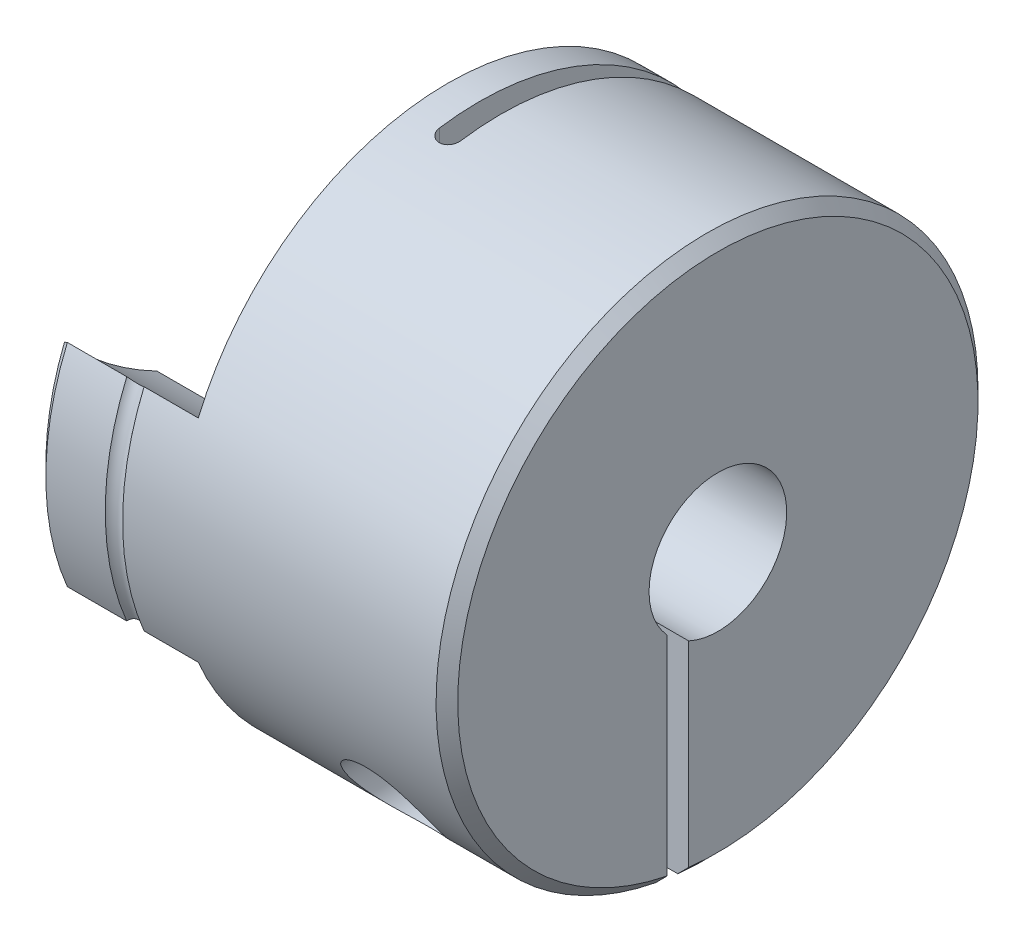
from build123d import *

# Parameters (mm, degrees)
SKETCH1_R                                            = 12.5
BOSS_EXTRUDE1_DEPTH                                  = 19
CUT_EXTRUDE1_REACH                                   = 27.952
SKETCH3_R                                            = 6.975
CUT_EXTRUDE2_DEPTH                                   = 6.54
SKETCH5_R                                            = 0.5
CUT_EXTRUDE4_DEPTH                                   = 17.5
CUT_EXTRUDE5_DEPTH                                   = 15
REFRENTADO_PARA_TORNILLO_TAP_N_CON_CABEZ_D           = 3.91
REFRENTADO_PARA_TORNILLO_TAP_N_CON_CABEZ_CBORE_D     = 6.5
REFRENTADO_PARA_TORNILLO_TAP_N_CON_CABEZ_CBORE_DEPTH = 8
CHAFL_N1_SIZE                                        = 0.5
DODANIE_WYCI_GNI_CIE1_START                          = -10
DODANIE_WYCI_GNI_CIE1_DEPTH                          = 10


with BuildPart() as part:
    # Sketch1 → Boss-Extrude1 (new body)
    with BuildSketch(Plane(origin=(0, 0, 0), x_dir=(0, 0, -1), z_dir=(1, 0, 0))):
        Circle(SKETCH1_R)
    extrude(amount=BOSS_EXTRUDE1_DEPTH)

    # Sketch3 → Cut-Extrude1 (cut, up to next)
    with BuildSketch(Plane.ZY, mode=Mode.PRIVATE) as cut_extrude1_sk1:
        Circle(SKETCH3_R)
    cut_extrude1_tool1 = extrude(cut_extrude1_sk1.sketch, amount=-CUT_EXTRUDE1_REACH, mode=Mode.PRIVATE) & part.part
    add(cut_extrude1_tool1.solids().sort_by_distance((0, 0, 0))[0], mode=Mode.SUBTRACT)

    # Sketch2 → Cut-Extrude2 (cut)
    with BuildSketch(Plane.ZY):
        with BuildLine():
            Line((6.876343086, 1.168987069), (6.876343086, -1.168987069))
            ThreePointArc((6.876343086, -1.168987069), (0, -29.5), (-6.876343086, -1.168987069))
            Line((-6.876343086, -1.168987069), (-6.876343086, 1.168987069))
            ThreePointArc((-6.876343086, 1.168987069), (0, 29.5), (6.876343086, 1.168987069))
        make_face()
    extrude(amount=-CUT_EXTRUDE2_DEPTH, mode=Mode.SUBTRACT)

    # Sketch5 → Cut-Revolve1 (revolve, cut)
    with BuildSketch(Plane(origin=(0, 0, 0), x_dir=(-1, 0, 0), z_dir=(0, -1, 0)), mode=Mode.PRIVATE) as cut_revolve1_sk:
        with Locations((-3.64, 12.8)):
            Circle(SKETCH5_R)
    revolve(cut_revolve1_sk.sketch.rotate(Axis((19, 0, 0), (-1, 0, 0)), 202.975957279), axis=Axis((19, 0, 0), (-1, 0, 0)), mode=Mode.SUBTRACT)

    # Sketch6 → Cut-Extrude4 (cut, symmetric)
    with BuildSketch(Plane(origin=(0, 0, 0), x_dir=(1, 0, 0), z_dir=(0, 1, 0))):
        with BuildLine():
            Line((9, 14.85), (9, -1.85))
            ThreePointArc((9, -1.85), (8.5, -2.35), (8, -1.85))
            Line((8, -1.85), (8, 14.85))
            Line((8, 14.85), (9, 14.85))
        make_face()
    extrude(amount=CUT_EXTRUDE4_DEPTH, both=True, mode=Mode.SUBTRACT)

    # Sketch9 → Cut-Extrude5 (cut)
    with BuildSketch(Plane(origin=(0, 0, 0), x_dir=(1, 0, 0), z_dir=(0, 1, 0))):
        with BuildLine():
            Line((8.5, -1.35), (27.798520731, -1.35))
            ThreePointArc((27.798520731, -1.35), (28.298520731, -1.85), (27.798520731, -2.35))
            Line((27.798520731, -2.35), (8.5, -2.35))
            ThreePointArc((8.5, -2.35), (8, -1.85), (8.5, -1.35))
        make_face()
    extrude(amount=-CUT_EXTRUDE5_DEPTH, mode=Mode.SUBTRACT)

    # Refrentado para tornillo tapón con cabeza de clavija de M2.51 (through all)
    with Locations(Plane(origin=(0, 0, -13.65), x_dir=(1, 0, 0), z_dir=(0, 0, -1))):
        with Locations((14, 7.426886175)):
            CounterBoreHole(REFRENTADO_PARA_TORNILLO_TAP_N_CON_CABEZ_D / 2, REFRENTADO_PARA_TORNILLO_TAP_N_CON_CABEZ_CBORE_D / 2, REFRENTADO_PARA_TORNILLO_TAP_N_CON_CABEZ_CBORE_DEPTH)

    # Chaflán1
    chafl_n1_edges = [part.edges().sort_by_distance(p)[0] for p in [
        (0, 0, 12.5),
        (0, 0, -12.5),
        (19, 9.633924434, 7.964766161),
    ]]
    chamfer(chafl_n1_edges, length=CHAFL_N1_SIZE)

    # Szkic1 → Dodanie-wyciągnięcie1 (add)
    with BuildSketch(Plane(origin=(19, 0, 0), x_dir=(0, 0, -1), z_dir=(1, 0, 0)).offset(DODANIE_WYCI_GNI_CIE1_START)):
        with BuildLine():
            Line((-2.35, -6.567200697), (-2.35, -2.134976581))
            ThreePointArc((-2.35, -2.134976581), (1.88651169, 2.553761665), (-1.35, -2.873695356))
            Line((-1.35, -2.873695356), (-1.35, -6.843107847))
            ThreePointArc((-1.35, -6.843107847), (1.855136434, 6.723770803), (-2.35, -6.567200697))
        make_face()
    extrude(amount=DODANIE_WYCI_GNI_CIE1_DEPTH)


solid = part.part
